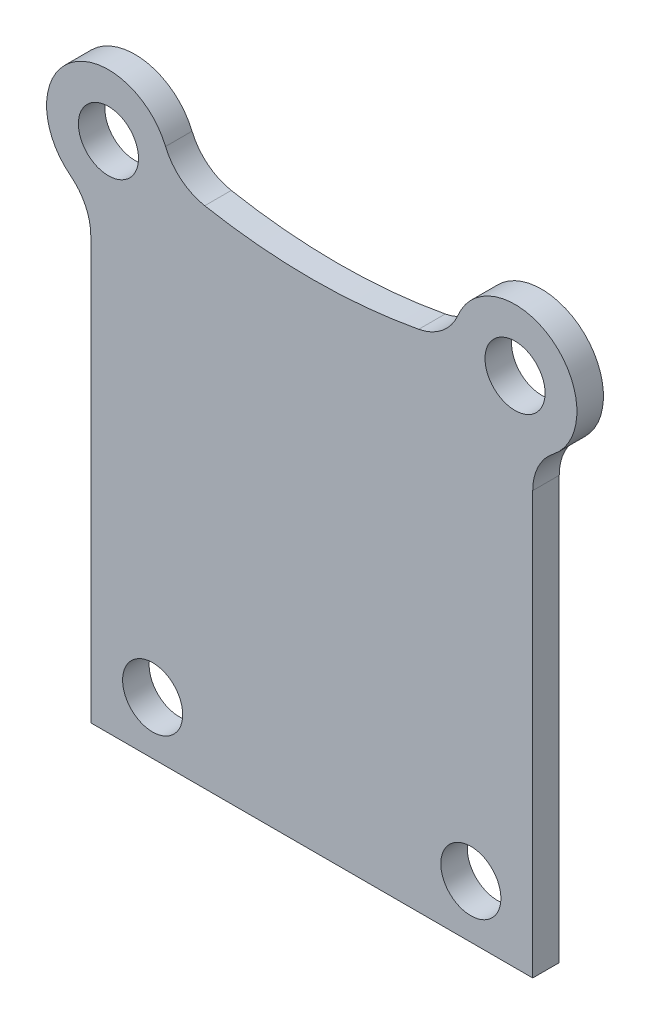
from build123d import *

# Parameters (mm, degrees)
EXTRUDE_1_DEPTH   = 1.5
HOLE_WIZARD_M31_D = 3.4


with BuildPart() as part:
    # Эскиз1 → Бобышка-Вытянуть1 (new body)
    with BuildSketch(Plane.XY):
        with BuildLine():
            Line((-12.5, -56.123475383), (-12.5, -80))
            Line((-12.5, -80), (12.5, -80))
            Line((12.5, -80), (12.5, -56.123475383))
            ThreePointArc((12.5, -56.123475383), (12.803848897, -54.807888354), (13.653846154, -53.758794437))
            ThreePointArc((13.653846154, -53.758794437), (13.623122203, -48.217491759), (8.270384407, -49.651080759))
            ThreePointArc((8.270384407, -49.651080759), (7.388025887, -50.827983152), (6.0522893, -51.4439893))
            ThreePointArc((6.0522893, -51.4439893), (0, -52.003676272), (-6.0522893, -51.4439893))
            ThreePointArc((-6.0522893, -51.4439893), (-7.388025887, -50.827983152), (-8.270384407, -49.651080759))
            ThreePointArc((-8.270384407, -49.651080759), (-13.623122203, -48.217491759), (-13.653846154, -53.758794437))
            ThreePointArc((-13.653846154, -53.758794437), (-12.803848897, -54.807888354), (-12.5, -56.123475383))
        make_face()
    extrude(amount=-EXTRUDE_1_DEPTH)

    # Отверстие с зазором M31 (through all)
    with Locations(Plane.XY):
        with Locations((11.5, -51), (-11.5, -51), (9, -77), (-9, -77)):
            Hole(HOLE_WIZARD_M31_D / 2)


solid = part.part
